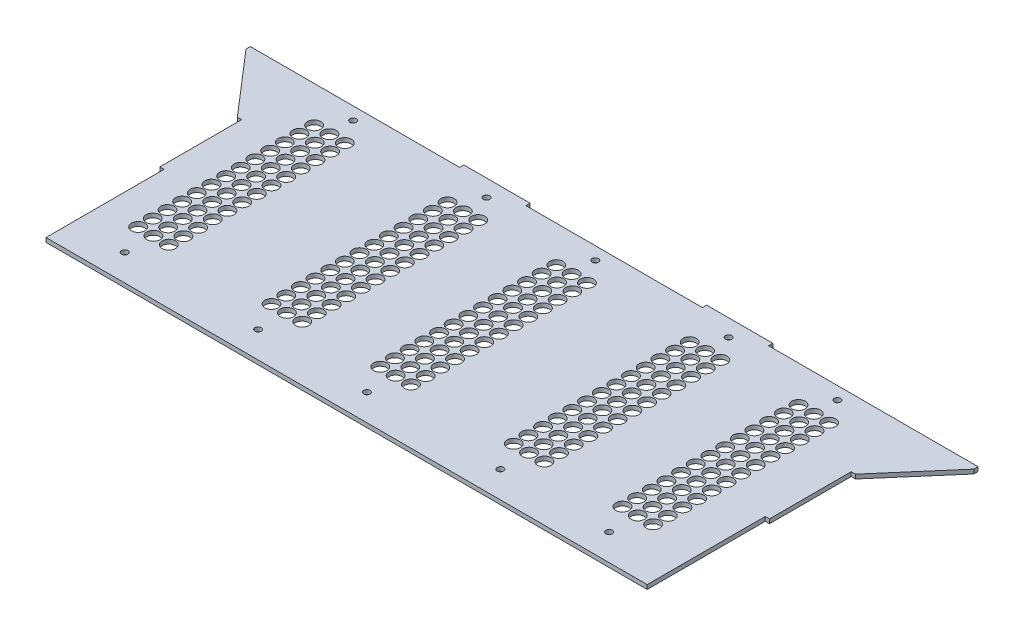
from build123d import *

# Parameters (mm, degrees)
SKETCH1_W                  = 457.2230066
SKETCH1_H                  = 3.175
BOSS_EXTRUDE1_DEPTH        = 200.6419914
BOSS_EXTRUDE3_DEPTH        = 3.175
SKETCH5_W                  = 3.175
SKETCH5_H                  = 88.514
CUT_EXTRUDE2_DEPTH         = 3.175
SKETCH3_W                  = 49.658811606
SKETCH3_H                  = 3.175
BOSS_EXTRUDE4_DEPTH        = 3.18
M4_CLEARANCE_HOLE1_D       = 4.8
LPATTERN5_COUNT            = 3
LPATTERN5_PITCH            = 181.61399999
M4_CLEARANCE_HOLE2_D       = 4.8
LPATTERN6_COUNT            = 2
LPATTERN6_PITCH            = 181.61399999
SKETCH10_R                 = 5
CUT_EXTRUDE3_DEPTH         = 339.72456808
LPATTERN1_COUNT            = 13
LPATTERN1_PITCH            = 11
LPATTERN2_COUNT            = 3
LPATTERN2_PITCH            = 181.61399999
LPATTERN2_COPY_1_SKETCH_R  = 5
LPATTERN2_COPY_1_DEPTH     = 339.72456808
LPATTERN2_COPY_2_SKETCH_R  = 5
LPATTERN2_COPY_2_DEPTH     = 339.72456808
LPATTERN2_COPY_3_SKETCH_R  = 5
LPATTERN2_COPY_3_DEPTH     = 339.72456808
LPATTERN2_COPY_4_SKETCH_R  = 5
LPATTERN2_COPY_4_DEPTH     = 339.72456808
LPATTERN2_COPY_5_SKETCH_R  = 5
LPATTERN2_COPY_5_DEPTH     = 339.72456808
LPATTERN2_COPY_6_SKETCH_R  = 5
LPATTERN2_COPY_6_DEPTH     = 339.72456808
LPATTERN2_COPY_7_SKETCH_R  = 5
LPATTERN2_COPY_7_DEPTH     = 339.72456808
LPATTERN2_COPY_8_SKETCH_R  = 5
LPATTERN2_COPY_8_DEPTH     = 339.72456808
LPATTERN2_COPY_9_SKETCH_R  = 5
LPATTERN2_COPY_9_DEPTH     = 339.72456808
LPATTERN2_COPY_10_SKETCH_R = 5
LPATTERN2_COPY_10_DEPTH    = 339.72456808
LPATTERN2_COPY_11_SKETCH_R = 5
LPATTERN2_COPY_11_DEPTH    = 339.72456808
LPATTERN2_COPY_12_SKETCH_R = 5
LPATTERN2_COPY_12_DEPTH    = 339.72456808
LPATTERN2_COPY_13_SKETCH_R = 5
LPATTERN2_COPY_13_DEPTH    = 339.72456808
LPATTERN2_COPY_14_SKETCH_R = 5
LPATTERN2_COPY_14_DEPTH    = 339.72456808
LPATTERN2_COPY_15_SKETCH_R = 5
LPATTERN2_COPY_15_DEPTH    = 339.72456808
LPATTERN2_COPY_16_SKETCH_R = 5
LPATTERN2_COPY_16_DEPTH    = 339.72456808
LPATTERN2_COPY_17_SKETCH_R = 5
LPATTERN2_COPY_17_DEPTH    = 339.72456808
LPATTERN2_COPY_18_SKETCH_R = 5
LPATTERN2_COPY_18_DEPTH    = 339.72456808
LPATTERN2_COPY_19_SKETCH_R = 5
LPATTERN2_COPY_19_DEPTH    = 339.72456808
LPATTERN2_COPY_20_SKETCH_R = 5
LPATTERN2_COPY_20_DEPTH    = 339.72456808
LPATTERN2_COPY_21_SKETCH_R = 5
LPATTERN2_COPY_21_DEPTH    = 339.72456808
LPATTERN2_COPY_22_SKETCH_R = 5
LPATTERN2_COPY_22_DEPTH    = 339.72456808
LPATTERN2_COPY_23_SKETCH_R = 5
LPATTERN2_COPY_23_DEPTH    = 339.72456808
LPATTERN2_COPY_24_SKETCH_R = 5
LPATTERN2_COPY_24_DEPTH    = 339.72456808
SKETCH11_R                 = 5
CUT_EXTRUDE4_DEPTH         = 339.72456808
LPATTERN3_COUNT            = 13
LPATTERN3_PITCH            = 11
LPATTERN4_COUNT            = 2
LPATTERN4_PITCH            = 181.61399999
LPATTERN4_COPY_1_SKETCH_R  = 5
LPATTERN4_COPY_1_DEPTH     = 339.72456808
LPATTERN4_COPY_2_SKETCH_R  = 5
LPATTERN4_COPY_2_DEPTH     = 339.72456808
LPATTERN4_COPY_3_SKETCH_R  = 5
LPATTERN4_COPY_3_DEPTH     = 339.72456808
LPATTERN4_COPY_4_SKETCH_R  = 5
LPATTERN4_COPY_4_DEPTH     = 339.72456808
LPATTERN4_COPY_5_SKETCH_R  = 5
LPATTERN4_COPY_5_DEPTH     = 339.72456808
LPATTERN4_COPY_6_SKETCH_R  = 5
LPATTERN4_COPY_6_DEPTH     = 339.72456808
LPATTERN4_COPY_7_SKETCH_R  = 5
LPATTERN4_COPY_7_DEPTH     = 339.72456808
LPATTERN4_COPY_8_SKETCH_R  = 5
LPATTERN4_COPY_8_DEPTH     = 339.72456808
LPATTERN4_COPY_9_SKETCH_R  = 5
LPATTERN4_COPY_9_DEPTH     = 339.72456808
LPATTERN4_COPY_10_SKETCH_R = 5
LPATTERN4_COPY_10_DEPTH    = 339.72456808
LPATTERN4_COPY_11_SKETCH_R = 5
LPATTERN4_COPY_11_DEPTH    = 339.72456808
LPATTERN4_COPY_12_SKETCH_R = 5
LPATTERN4_COPY_12_DEPTH    = 339.72456808


with BuildPart() as part:
    # Sketch1 → Boss-Extrude1 (new body)
    with BuildSketch(Plane.XY):
        Rectangle(SKETCH1_W, SKETCH1_H)
    extrude(amount=BOSS_EXTRUDE1_DEPTH)

    # Sketch4 → Boss-Extrude3 (add)
    with BuildSketch(Plane.XZ.offset(1.5875)):
        Polygon((-228.6115033, 0), (-272.8865033, 0), (-272.8865033, 3.175), (-231.7865033, 50.8), (-228.6115033, 50.8), align=None)
    boss_extrude3 = extrude(amount=-BOSS_EXTRUDE3_DEPTH)

    # Mirror1: Boss-Extrude3 across plane
    add(boss_extrude3.mirror(Plane(origin=(0, 0, 0), x_dir=(0, 0, 1), z_dir=(1, 0, 0))))

    # Sketch5 → Cut-Extrude2 (cut)
    with BuildSketch(Plane.XZ.offset(1.5875)):
        with Locations((-227.0240033, 156.3849914)):
            Rectangle(SKETCH5_W, SKETCH5_H)
    cut_extrude2 = extrude(amount=-CUT_EXTRUDE2_DEPTH, mode=Mode.SUBTRACT)

    # Mirror2: Cut-Extrude2 across plane
    add(cut_extrude2.mirror(Plane(origin=(0, 0, 0), x_dir=(0, 0, 1), z_dir=(1, 0, 0))), mode=Mode.SUBTRACT)

    # Sketch3 → Boss-Extrude4 (add)
    with BuildSketch(Plane(origin=(0, 0, 0), x_dir=(-1, 0, 0), z_dir=(0, 0, -1))):
        with Locations((-91.020094169, 0)):
            Rectangle(SKETCH3_W, SKETCH3_H)
        with Locations((91.020094169, 0)):
            Rectangle(SKETCH3_W, SKETCH3_H)
    extrude(amount=BOSS_EXTRUDE4_DEPTH)

    # M4 Clearance Hole1 (through all)
    with Locations(Plane.XZ.offset(1.5875)):
        with Locations((-186.2355, 9.525), (-186.2355, 180.775)):
            m4_clearance_hole1 = Hole(M4_CLEARANCE_HOLE1_D / 2)

    # LPattern5: M4 Clearance Hole1 ×3
    with Locations(*[(i * LPATTERN5_PITCH, 0, 0) for i in range(1, LPATTERN5_COUNT)]):
        add(m4_clearance_hole1, mode=Mode.SUBTRACT)

    # M4 Clearance Hole2 (through all)
    with Locations(Plane.XZ.offset(1.5875)):
        with Locations((-86.1905, 9.525), (-86.1905, 180.775)):
            m4_clearance_hole2 = Hole(M4_CLEARANCE_HOLE2_D / 2)

    # LPattern6: M4 Clearance Hole2 ×2
    with Locations(*[(i * LPATTERN6_PITCH, 0, 0) for i in range(1, LPATTERN6_COUNT)]):
        add(m4_clearance_hole2, mode=Mode.SUBTRACT)

    # Sketch10 → Cut-Extrude3 (cut, through all)
    with BuildSketch(Plane.XZ.offset(1.5875)):
        with Locations(Location((-197.7355, 159.256662939, 0), (0, 0, 270))):
            Circle(SKETCH10_R)
        with Locations(Location((-186.2355, 159.256662939, 0), (0, 0, 270))):
            Circle(SKETCH10_R)
        with Locations(Location((-174.7355, 159.256662939, 0), (0, 0, 270))):
            Circle(SKETCH10_R)
    cut_extrude3 = extrude(amount=-CUT_EXTRUDE3_DEPTH, mode=Mode.SUBTRACT)

    # LPattern1: Cut-Extrude3 ×13
    with Locations(*[(0, 0, -i * LPATTERN1_PITCH) for i in range(1, LPATTERN1_COUNT)]):
        add(cut_extrude3, mode=Mode.SUBTRACT)

    # LPattern2: Cut-Extrude3 ×3
    with Locations(*[(i * LPATTERN2_PITCH, 0, 0) for i in range(1, LPATTERN2_COUNT)]):
        add(cut_extrude3, mode=Mode.SUBTRACT)

    # LPattern2 copy 1 sketch → LPattern2 copy 1 (cut, through all)
    with BuildSketch(Plane(origin=(181.61399999, -1.5875, -11), x_dir=(1, 0, 0), z_dir=(0, -1, 0))):
        with Locations(Location((-197.7355, 159.256662939, 0), (0, 0, 270))):
            Circle(LPATTERN2_COPY_1_SKETCH_R)
        with Locations(Location((-186.2355, 159.256662939, 0), (0, 0, 270))):
            Circle(LPATTERN2_COPY_1_SKETCH_R)
        with Locations(Location((-174.7355, 159.256662939, 0), (0, 0, 270))):
            Circle(LPATTERN2_COPY_1_SKETCH_R)
    extrude(amount=-LPATTERN2_COPY_1_DEPTH, mode=Mode.SUBTRACT)

    # LPattern2 copy 2 sketch → LPattern2 copy 2 (cut, through all)
    with BuildSketch(Plane(origin=(363.22799998, -1.5875, -11), x_dir=(1, 0, 0), z_dir=(0, -1, 0))):
        with Locations(Location((-197.7355, 159.256662939, 0), (0, 0, 270))):
            Circle(LPATTERN2_COPY_2_SKETCH_R)
        with Locations(Location((-186.2355, 159.256662939, 0), (0, 0, 270))):
            Circle(LPATTERN2_COPY_2_SKETCH_R)
        with Locations(Location((-174.7355, 159.256662939, 0), (0, 0, 270))):
            Circle(LPATTERN2_COPY_2_SKETCH_R)
    extrude(amount=-LPATTERN2_COPY_2_DEPTH, mode=Mode.SUBTRACT)

    # LPattern2 copy 3 sketch → LPattern2 copy 3 (cut, through all)
    with BuildSketch(Plane(origin=(181.61399999, -1.5875, -22), x_dir=(1, 0, 0), z_dir=(0, -1, 0))):
        with Locations(Location((-197.7355, 159.256662939, 0), (0, 0, 270))):
            Circle(LPATTERN2_COPY_3_SKETCH_R)
        with Locations(Location((-186.2355, 159.256662939, 0), (0, 0, 270))):
            Circle(LPATTERN2_COPY_3_SKETCH_R)
        with Locations(Location((-174.7355, 159.256662939, 0), (0, 0, 270))):
            Circle(LPATTERN2_COPY_3_SKETCH_R)
    extrude(amount=-LPATTERN2_COPY_3_DEPTH, mode=Mode.SUBTRACT)

    # LPattern2 copy 4 sketch → LPattern2 copy 4 (cut, through all)
    with BuildSketch(Plane(origin=(363.22799998, -1.5875, -22), x_dir=(1, 0, 0), z_dir=(0, -1, 0))):
        with Locations(Location((-197.7355, 159.256662939, 0), (0, 0, 270))):
            Circle(LPATTERN2_COPY_4_SKETCH_R)
        with Locations(Location((-186.2355, 159.256662939, 0), (0, 0, 270))):
            Circle(LPATTERN2_COPY_4_SKETCH_R)
        with Locations(Location((-174.7355, 159.256662939, 0), (0, 0, 270))):
            Circle(LPATTERN2_COPY_4_SKETCH_R)
    extrude(amount=-LPATTERN2_COPY_4_DEPTH, mode=Mode.SUBTRACT)

    # LPattern2 copy 5 sketch → LPattern2 copy 5 (cut, through all)
    with BuildSketch(Plane(origin=(181.61399999, -1.5875, -33), x_dir=(1, 0, 0), z_dir=(0, -1, 0))):
        with Locations(Location((-197.7355, 159.256662939, 0), (0, 0, 270))):
            Circle(LPATTERN2_COPY_5_SKETCH_R)
        with Locations(Location((-186.2355, 159.256662939, 0), (0, 0, 270))):
            Circle(LPATTERN2_COPY_5_SKETCH_R)
        with Locations(Location((-174.7355, 159.256662939, 0), (0, 0, 270))):
            Circle(LPATTERN2_COPY_5_SKETCH_R)
    extrude(amount=-LPATTERN2_COPY_5_DEPTH, mode=Mode.SUBTRACT)

    # LPattern2 copy 6 sketch → LPattern2 copy 6 (cut, through all)
    with BuildSketch(Plane(origin=(363.22799998, -1.5875, -33), x_dir=(1, 0, 0), z_dir=(0, -1, 0))):
        with Locations(Location((-197.7355, 159.256662939, 0), (0, 0, 270))):
            Circle(LPATTERN2_COPY_6_SKETCH_R)
        with Locations(Location((-186.2355, 159.256662939, 0), (0, 0, 270))):
            Circle(LPATTERN2_COPY_6_SKETCH_R)
        with Locations(Location((-174.7355, 159.256662939, 0), (0, 0, 270))):
            Circle(LPATTERN2_COPY_6_SKETCH_R)
    extrude(amount=-LPATTERN2_COPY_6_DEPTH, mode=Mode.SUBTRACT)

    # LPattern2 copy 7 sketch → LPattern2 copy 7 (cut, through all)
    with BuildSketch(Plane(origin=(181.61399999, -1.5875, -44), x_dir=(1, 0, 0), z_dir=(0, -1, 0))):
        with Locations(Location((-197.7355, 159.256662939, 0), (0, 0, 270))):
            Circle(LPATTERN2_COPY_7_SKETCH_R)
        with Locations(Location((-186.2355, 159.256662939, 0), (0, 0, 270))):
            Circle(LPATTERN2_COPY_7_SKETCH_R)
        with Locations(Location((-174.7355, 159.256662939, 0), (0, 0, 270))):
            Circle(LPATTERN2_COPY_7_SKETCH_R)
    extrude(amount=-LPATTERN2_COPY_7_DEPTH, mode=Mode.SUBTRACT)

    # LPattern2 copy 8 sketch → LPattern2 copy 8 (cut, through all)
    with BuildSketch(Plane(origin=(363.22799998, -1.5875, -44), x_dir=(1, 0, 0), z_dir=(0, -1, 0))):
        with Locations(Location((-197.7355, 159.256662939, 0), (0, 0, 270))):
            Circle(LPATTERN2_COPY_8_SKETCH_R)
        with Locations(Location((-186.2355, 159.256662939, 0), (0, 0, 270))):
            Circle(LPATTERN2_COPY_8_SKETCH_R)
        with Locations(Location((-174.7355, 159.256662939, 0), (0, 0, 270))):
            Circle(LPATTERN2_COPY_8_SKETCH_R)
    extrude(amount=-LPATTERN2_COPY_8_DEPTH, mode=Mode.SUBTRACT)

    # LPattern2 copy 9 sketch → LPattern2 copy 9 (cut, through all)
    with BuildSketch(Plane(origin=(181.61399999, -1.5875, -55), x_dir=(1, 0, 0), z_dir=(0, -1, 0))):
        with Locations(Location((-197.7355, 159.256662939, 0), (0, 0, 270))):
            Circle(LPATTERN2_COPY_9_SKETCH_R)
        with Locations(Location((-186.2355, 159.256662939, 0), (0, 0, 270))):
            Circle(LPATTERN2_COPY_9_SKETCH_R)
        with Locations(Location((-174.7355, 159.256662939, 0), (0, 0, 270))):
            Circle(LPATTERN2_COPY_9_SKETCH_R)
    extrude(amount=-LPATTERN2_COPY_9_DEPTH, mode=Mode.SUBTRACT)

    # LPattern2 copy 10 sketch → LPattern2 copy 10 (cut, through all)
    with BuildSketch(Plane(origin=(363.22799998, -1.5875, -55), x_dir=(1, 0, 0), z_dir=(0, -1, 0))):
        with Locations(Location((-197.7355, 159.256662939, 0), (0, 0, 270))):
            Circle(LPATTERN2_COPY_10_SKETCH_R)
        with Locations(Location((-186.2355, 159.256662939, 0), (0, 0, 270))):
            Circle(LPATTERN2_COPY_10_SKETCH_R)
        with Locations(Location((-174.7355, 159.256662939, 0), (0, 0, 270))):
            Circle(LPATTERN2_COPY_10_SKETCH_R)
    extrude(amount=-LPATTERN2_COPY_10_DEPTH, mode=Mode.SUBTRACT)

    # LPattern2 copy 11 sketch → LPattern2 copy 11 (cut, through all)
    with BuildSketch(Plane(origin=(181.61399999, -1.5875, -66), x_dir=(1, 0, 0), z_dir=(0, -1, 0))):
        with Locations(Location((-197.7355, 159.256662939, 0), (0, 0, 270))):
            Circle(LPATTERN2_COPY_11_SKETCH_R)
        with Locations(Location((-186.2355, 159.256662939, 0), (0, 0, 270))):
            Circle(LPATTERN2_COPY_11_SKETCH_R)
        with Locations(Location((-174.7355, 159.256662939, 0), (0, 0, 270))):
            Circle(LPATTERN2_COPY_11_SKETCH_R)
    extrude(amount=-LPATTERN2_COPY_11_DEPTH, mode=Mode.SUBTRACT)

    # LPattern2 copy 12 sketch → LPattern2 copy 12 (cut, through all)
    with BuildSketch(Plane(origin=(363.22799998, -1.5875, -66), x_dir=(1, 0, 0), z_dir=(0, -1, 0))):
        with Locations(Location((-197.7355, 159.256662939, 0), (0, 0, 270))):
            Circle(LPATTERN2_COPY_12_SKETCH_R)
        with Locations(Location((-186.2355, 159.256662939, 0), (0, 0, 270))):
            Circle(LPATTERN2_COPY_12_SKETCH_R)
        with Locations(Location((-174.7355, 159.256662939, 0), (0, 0, 270))):
            Circle(LPATTERN2_COPY_12_SKETCH_R)
    extrude(amount=-LPATTERN2_COPY_12_DEPTH, mode=Mode.SUBTRACT)

    # LPattern2 copy 13 sketch → LPattern2 copy 13 (cut, through all)
    with BuildSketch(Plane(origin=(181.61399999, -1.5875, -77), x_dir=(1, 0, 0), z_dir=(0, -1, 0))):
        with Locations(Location((-197.7355, 159.256662939, 0), (0, 0, 270))):
            Circle(LPATTERN2_COPY_13_SKETCH_R)
        with Locations(Location((-186.2355, 159.256662939, 0), (0, 0, 270))):
            Circle(LPATTERN2_COPY_13_SKETCH_R)
        with Locations(Location((-174.7355, 159.256662939, 0), (0, 0, 270))):
            Circle(LPATTERN2_COPY_13_SKETCH_R)
    extrude(amount=-LPATTERN2_COPY_13_DEPTH, mode=Mode.SUBTRACT)

    # LPattern2 copy 14 sketch → LPattern2 copy 14 (cut, through all)
    with BuildSketch(Plane(origin=(363.22799998, -1.5875, -77), x_dir=(1, 0, 0), z_dir=(0, -1, 0))):
        with Locations(Location((-197.7355, 159.256662939, 0), (0, 0, 270))):
            Circle(LPATTERN2_COPY_14_SKETCH_R)
        with Locations(Location((-186.2355, 159.256662939, 0), (0, 0, 270))):
            Circle(LPATTERN2_COPY_14_SKETCH_R)
        with Locations(Location((-174.7355, 159.256662939, 0), (0, 0, 270))):
            Circle(LPATTERN2_COPY_14_SKETCH_R)
    extrude(amount=-LPATTERN2_COPY_14_DEPTH, mode=Mode.SUBTRACT)

    # LPattern2 copy 15 sketch → LPattern2 copy 15 (cut, through all)
    with BuildSketch(Plane(origin=(181.61399999, -1.5875, -88), x_dir=(1, 0, 0), z_dir=(0, -1, 0))):
        with Locations(Location((-197.7355, 159.256662939, 0), (0, 0, 270))):
            Circle(LPATTERN2_COPY_15_SKETCH_R)
        with Locations(Location((-186.2355, 159.256662939, 0), (0, 0, 270))):
            Circle(LPATTERN2_COPY_15_SKETCH_R)
        with Locations(Location((-174.7355, 159.256662939, 0), (0, 0, 270))):
            Circle(LPATTERN2_COPY_15_SKETCH_R)
    extrude(amount=-LPATTERN2_COPY_15_DEPTH, mode=Mode.SUBTRACT)

    # LPattern2 copy 16 sketch → LPattern2 copy 16 (cut, through all)
    with BuildSketch(Plane(origin=(363.22799998, -1.5875, -88), x_dir=(1, 0, 0), z_dir=(0, -1, 0))):
        with Locations(Location((-197.7355, 159.256662939, 0), (0, 0, 270))):
            Circle(LPATTERN2_COPY_16_SKETCH_R)
        with Locations(Location((-186.2355, 159.256662939, 0), (0, 0, 270))):
            Circle(LPATTERN2_COPY_16_SKETCH_R)
        with Locations(Location((-174.7355, 159.256662939, 0), (0, 0, 270))):
            Circle(LPATTERN2_COPY_16_SKETCH_R)
    extrude(amount=-LPATTERN2_COPY_16_DEPTH, mode=Mode.SUBTRACT)

    # LPattern2 copy 17 sketch → LPattern2 copy 17 (cut, through all)
    with BuildSketch(Plane(origin=(181.61399999, -1.5875, -99), x_dir=(1, 0, 0), z_dir=(0, -1, 0))):
        with Locations(Location((-197.7355, 159.256662939, 0), (0, 0, 270))):
            Circle(LPATTERN2_COPY_17_SKETCH_R)
        with Locations(Location((-186.2355, 159.256662939, 0), (0, 0, 270))):
            Circle(LPATTERN2_COPY_17_SKETCH_R)
        with Locations(Location((-174.7355, 159.256662939, 0), (0, 0, 270))):
            Circle(LPATTERN2_COPY_17_SKETCH_R)
    extrude(amount=-LPATTERN2_COPY_17_DEPTH, mode=Mode.SUBTRACT)

    # LPattern2 copy 18 sketch → LPattern2 copy 18 (cut, through all)
    with BuildSketch(Plane(origin=(363.22799998, -1.5875, -99), x_dir=(1, 0, 0), z_dir=(0, -1, 0))):
        with Locations(Location((-197.7355, 159.256662939, 0), (0, 0, 270))):
            Circle(LPATTERN2_COPY_18_SKETCH_R)
        with Locations(Location((-186.2355, 159.256662939, 0), (0, 0, 270))):
            Circle(LPATTERN2_COPY_18_SKETCH_R)
        with Locations(Location((-174.7355, 159.256662939, 0), (0, 0, 270))):
            Circle(LPATTERN2_COPY_18_SKETCH_R)
    extrude(amount=-LPATTERN2_COPY_18_DEPTH, mode=Mode.SUBTRACT)

    # LPattern2 copy 19 sketch → LPattern2 copy 19 (cut, through all)
    with BuildSketch(Plane(origin=(181.61399999, -1.5875, -110), x_dir=(1, 0, 0), z_dir=(0, -1, 0))):
        with Locations(Location((-197.7355, 159.256662939, 0), (0, 0, 270))):
            Circle(LPATTERN2_COPY_19_SKETCH_R)
        with Locations(Location((-186.2355, 159.256662939, 0), (0, 0, 270))):
            Circle(LPATTERN2_COPY_19_SKETCH_R)
        with Locations(Location((-174.7355, 159.256662939, 0), (0, 0, 270))):
            Circle(LPATTERN2_COPY_19_SKETCH_R)
    extrude(amount=-LPATTERN2_COPY_19_DEPTH, mode=Mode.SUBTRACT)

    # LPattern2 copy 20 sketch → LPattern2 copy 20 (cut, through all)
    with BuildSketch(Plane(origin=(363.22799998, -1.5875, -110), x_dir=(1, 0, 0), z_dir=(0, -1, 0))):
        with Locations(Location((-197.7355, 159.256662939, 0), (0, 0, 270))):
            Circle(LPATTERN2_COPY_20_SKETCH_R)
        with Locations(Location((-186.2355, 159.256662939, 0), (0, 0, 270))):
            Circle(LPATTERN2_COPY_20_SKETCH_R)
        with Locations(Location((-174.7355, 159.256662939, 0), (0, 0, 270))):
            Circle(LPATTERN2_COPY_20_SKETCH_R)
    extrude(amount=-LPATTERN2_COPY_20_DEPTH, mode=Mode.SUBTRACT)

    # LPattern2 copy 21 sketch → LPattern2 copy 21 (cut, through all)
    with BuildSketch(Plane(origin=(181.61399999, -1.5875, -121), x_dir=(1, 0, 0), z_dir=(0, -1, 0))):
        with Locations(Location((-197.7355, 159.256662939, 0), (0, 0, 270))):
            Circle(LPATTERN2_COPY_21_SKETCH_R)
        with Locations(Location((-186.2355, 159.256662939, 0), (0, 0, 270))):
            Circle(LPATTERN2_COPY_21_SKETCH_R)
        with Locations(Location((-174.7355, 159.256662939, 0), (0, 0, 270))):
            Circle(LPATTERN2_COPY_21_SKETCH_R)
    extrude(amount=-LPATTERN2_COPY_21_DEPTH, mode=Mode.SUBTRACT)

    # LPattern2 copy 22 sketch → LPattern2 copy 22 (cut, through all)
    with BuildSketch(Plane(origin=(363.22799998, -1.5875, -121), x_dir=(1, 0, 0), z_dir=(0, -1, 0))):
        with Locations(Location((-197.7355, 159.256662939, 0), (0, 0, 270))):
            Circle(LPATTERN2_COPY_22_SKETCH_R)
        with Locations(Location((-186.2355, 159.256662939, 0), (0, 0, 270))):
            Circle(LPATTERN2_COPY_22_SKETCH_R)
        with Locations(Location((-174.7355, 159.256662939, 0), (0, 0, 270))):
            Circle(LPATTERN2_COPY_22_SKETCH_R)
    extrude(amount=-LPATTERN2_COPY_22_DEPTH, mode=Mode.SUBTRACT)

    # LPattern2 copy 23 sketch → LPattern2 copy 23 (cut, through all)
    with BuildSketch(Plane(origin=(181.61399999, -1.5875, -132), x_dir=(1, 0, 0), z_dir=(0, -1, 0))):
        with Locations(Location((-197.7355, 159.256662939, 0), (0, 0, 270))):
            Circle(LPATTERN2_COPY_23_SKETCH_R)
        with Locations(Location((-186.2355, 159.256662939, 0), (0, 0, 270))):
            Circle(LPATTERN2_COPY_23_SKETCH_R)
        with Locations(Location((-174.7355, 159.256662939, 0), (0, 0, 270))):
            Circle(LPATTERN2_COPY_23_SKETCH_R)
    extrude(amount=-LPATTERN2_COPY_23_DEPTH, mode=Mode.SUBTRACT)

    # LPattern2 copy 24 sketch → LPattern2 copy 24 (cut, through all)
    with BuildSketch(Plane(origin=(363.22799998, -1.5875, -132), x_dir=(1, 0, 0), z_dir=(0, -1, 0))):
        with Locations(Location((-197.7355, 159.256662939, 0), (0, 0, 270))):
            Circle(LPATTERN2_COPY_24_SKETCH_R)
        with Locations(Location((-186.2355, 159.256662939, 0), (0, 0, 270))):
            Circle(LPATTERN2_COPY_24_SKETCH_R)
        with Locations(Location((-174.7355, 159.256662939, 0), (0, 0, 270))):
            Circle(LPATTERN2_COPY_24_SKETCH_R)
    extrude(amount=-LPATTERN2_COPY_24_DEPTH, mode=Mode.SUBTRACT)

    # Sketch11 → Cut-Extrude4 (cut, through all)
    with BuildSketch(Plane.XZ.offset(1.5875)):
        with Locations(Location((-97.6905, 159.256662939, 0), (0, 0, 270))):
            Circle(SKETCH11_R)
        with Locations(Location((-86.1905, 159.256662939, 0), (0, 0, 270))):
            Circle(SKETCH11_R)
        with Locations(Location((-74.6905, 159.256662939, 0), (0, 0, 270))):
            Circle(SKETCH11_R)
    cut_extrude4 = extrude(amount=-CUT_EXTRUDE4_DEPTH, mode=Mode.SUBTRACT)

    # LPattern3: Cut-Extrude4 ×13
    with Locations(*[(0, 0, -i * LPATTERN3_PITCH) for i in range(1, LPATTERN3_COUNT)]):
        add(cut_extrude4, mode=Mode.SUBTRACT)

    # LPattern4: Cut-Extrude4 ×2
    with Locations(*[(i * LPATTERN4_PITCH, 0, 0) for i in range(1, LPATTERN4_COUNT)]):
        add(cut_extrude4, mode=Mode.SUBTRACT)

    # LPattern4 copy 1 sketch → LPattern4 copy 1 (cut, through all)
    with BuildSketch(Plane(origin=(181.61399999, -1.5875, -11), x_dir=(1, 0, 0), z_dir=(0, -1, 0))):
        with Locations(Location((-97.6905, 159.256662939, 0), (0, 0, 270))):
            Circle(LPATTERN4_COPY_1_SKETCH_R)
        with Locations(Location((-86.1905, 159.256662939, 0), (0, 0, 270))):
            Circle(LPATTERN4_COPY_1_SKETCH_R)
        with Locations(Location((-74.6905, 159.256662939, 0), (0, 0, 270))):
            Circle(LPATTERN4_COPY_1_SKETCH_R)
    extrude(amount=-LPATTERN4_COPY_1_DEPTH, mode=Mode.SUBTRACT)

    # LPattern4 copy 2 sketch → LPattern4 copy 2 (cut, through all)
    with BuildSketch(Plane(origin=(181.61399999, -1.5875, -22), x_dir=(1, 0, 0), z_dir=(0, -1, 0))):
        with Locations(Location((-97.6905, 159.256662939, 0), (0, 0, 270))):
            Circle(LPATTERN4_COPY_2_SKETCH_R)
        with Locations(Location((-86.1905, 159.256662939, 0), (0, 0, 270))):
            Circle(LPATTERN4_COPY_2_SKETCH_R)
        with Locations(Location((-74.6905, 159.256662939, 0), (0, 0, 270))):
            Circle(LPATTERN4_COPY_2_SKETCH_R)
    extrude(amount=-LPATTERN4_COPY_2_DEPTH, mode=Mode.SUBTRACT)

    # LPattern4 copy 3 sketch → LPattern4 copy 3 (cut, through all)
    with BuildSketch(Plane(origin=(181.61399999, -1.5875, -33), x_dir=(1, 0, 0), z_dir=(0, -1, 0))):
        with Locations(Location((-97.6905, 159.256662939, 0), (0, 0, 270))):
            Circle(LPATTERN4_COPY_3_SKETCH_R)
        with Locations(Location((-86.1905, 159.256662939, 0), (0, 0, 270))):
            Circle(LPATTERN4_COPY_3_SKETCH_R)
        with Locations(Location((-74.6905, 159.256662939, 0), (0, 0, 270))):
            Circle(LPATTERN4_COPY_3_SKETCH_R)
    extrude(amount=-LPATTERN4_COPY_3_DEPTH, mode=Mode.SUBTRACT)

    # LPattern4 copy 4 sketch → LPattern4 copy 4 (cut, through all)
    with BuildSketch(Plane(origin=(181.61399999, -1.5875, -44), x_dir=(1, 0, 0), z_dir=(0, -1, 0))):
        with Locations(Location((-97.6905, 159.256662939, 0), (0, 0, 270))):
            Circle(LPATTERN4_COPY_4_SKETCH_R)
        with Locations(Location((-86.1905, 159.256662939, 0), (0, 0, 270))):
            Circle(LPATTERN4_COPY_4_SKETCH_R)
        with Locations(Location((-74.6905, 159.256662939, 0), (0, 0, 270))):
            Circle(LPATTERN4_COPY_4_SKETCH_R)
    extrude(amount=-LPATTERN4_COPY_4_DEPTH, mode=Mode.SUBTRACT)

    # LPattern4 copy 5 sketch → LPattern4 copy 5 (cut, through all)
    with BuildSketch(Plane(origin=(181.61399999, -1.5875, -55), x_dir=(1, 0, 0), z_dir=(0, -1, 0))):
        with Locations(Location((-97.6905, 159.256662939, 0), (0, 0, 270))):
            Circle(LPATTERN4_COPY_5_SKETCH_R)
        with Locations(Location((-86.1905, 159.256662939, 0), (0, 0, 270))):
            Circle(LPATTERN4_COPY_5_SKETCH_R)
        with Locations(Location((-74.6905, 159.256662939, 0), (0, 0, 270))):
            Circle(LPATTERN4_COPY_5_SKETCH_R)
    extrude(amount=-LPATTERN4_COPY_5_DEPTH, mode=Mode.SUBTRACT)

    # LPattern4 copy 6 sketch → LPattern4 copy 6 (cut, through all)
    with BuildSketch(Plane(origin=(181.61399999, -1.5875, -66), x_dir=(1, 0, 0), z_dir=(0, -1, 0))):
        with Locations(Location((-97.6905, 159.256662939, 0), (0, 0, 270))):
            Circle(LPATTERN4_COPY_6_SKETCH_R)
        with Locations(Location((-86.1905, 159.256662939, 0), (0, 0, 270))):
            Circle(LPATTERN4_COPY_6_SKETCH_R)
        with Locations(Location((-74.6905, 159.256662939, 0), (0, 0, 270))):
            Circle(LPATTERN4_COPY_6_SKETCH_R)
    extrude(amount=-LPATTERN4_COPY_6_DEPTH, mode=Mode.SUBTRACT)

    # LPattern4 copy 7 sketch → LPattern4 copy 7 (cut, through all)
    with BuildSketch(Plane(origin=(181.61399999, -1.5875, -77), x_dir=(1, 0, 0), z_dir=(0, -1, 0))):
        with Locations(Location((-97.6905, 159.256662939, 0), (0, 0, 270))):
            Circle(LPATTERN4_COPY_7_SKETCH_R)
        with Locations(Location((-86.1905, 159.256662939, 0), (0, 0, 270))):
            Circle(LPATTERN4_COPY_7_SKETCH_R)
        with Locations(Location((-74.6905, 159.256662939, 0), (0, 0, 270))):
            Circle(LPATTERN4_COPY_7_SKETCH_R)
    extrude(amount=-LPATTERN4_COPY_7_DEPTH, mode=Mode.SUBTRACT)

    # LPattern4 copy 8 sketch → LPattern4 copy 8 (cut, through all)
    with BuildSketch(Plane(origin=(181.61399999, -1.5875, -88), x_dir=(1, 0, 0), z_dir=(0, -1, 0))):
        with Locations(Location((-97.6905, 159.256662939, 0), (0, 0, 270))):
            Circle(LPATTERN4_COPY_8_SKETCH_R)
        with Locations(Location((-86.1905, 159.256662939, 0), (0, 0, 270))):
            Circle(LPATTERN4_COPY_8_SKETCH_R)
        with Locations(Location((-74.6905, 159.256662939, 0), (0, 0, 270))):
            Circle(LPATTERN4_COPY_8_SKETCH_R)
    extrude(amount=-LPATTERN4_COPY_8_DEPTH, mode=Mode.SUBTRACT)

    # LPattern4 copy 9 sketch → LPattern4 copy 9 (cut, through all)
    with BuildSketch(Plane(origin=(181.61399999, -1.5875, -99), x_dir=(1, 0, 0), z_dir=(0, -1, 0))):
        with Locations(Location((-97.6905, 159.256662939, 0), (0, 0, 270))):
            Circle(LPATTERN4_COPY_9_SKETCH_R)
        with Locations(Location((-86.1905, 159.256662939, 0), (0, 0, 270))):
            Circle(LPATTERN4_COPY_9_SKETCH_R)
        with Locations(Location((-74.6905, 159.256662939, 0), (0, 0, 270))):
            Circle(LPATTERN4_COPY_9_SKETCH_R)
    extrude(amount=-LPATTERN4_COPY_9_DEPTH, mode=Mode.SUBTRACT)

    # LPattern4 copy 10 sketch → LPattern4 copy 10 (cut, through all)
    with BuildSketch(Plane(origin=(181.61399999, -1.5875, -110), x_dir=(1, 0, 0), z_dir=(0, -1, 0))):
        with Locations(Location((-97.6905, 159.256662939, 0), (0, 0, 270))):
            Circle(LPATTERN4_COPY_10_SKETCH_R)
        with Locations(Location((-86.1905, 159.256662939, 0), (0, 0, 270))):
            Circle(LPATTERN4_COPY_10_SKETCH_R)
        with Locations(Location((-74.6905, 159.256662939, 0), (0, 0, 270))):
            Circle(LPATTERN4_COPY_10_SKETCH_R)
    extrude(amount=-LPATTERN4_COPY_10_DEPTH, mode=Mode.SUBTRACT)

    # LPattern4 copy 11 sketch → LPattern4 copy 11 (cut, through all)
    with BuildSketch(Plane(origin=(181.61399999, -1.5875, -121), x_dir=(1, 0, 0), z_dir=(0, -1, 0))):
        with Locations(Location((-97.6905, 159.256662939, 0), (0, 0, 270))):
            Circle(LPATTERN4_COPY_11_SKETCH_R)
        with Locations(Location((-86.1905, 159.256662939, 0), (0, 0, 270))):
            Circle(LPATTERN4_COPY_11_SKETCH_R)
        with Locations(Location((-74.6905, 159.256662939, 0), (0, 0, 270))):
            Circle(LPATTERN4_COPY_11_SKETCH_R)
    extrude(amount=-LPATTERN4_COPY_11_DEPTH, mode=Mode.SUBTRACT)

    # LPattern4 copy 12 sketch → LPattern4 copy 12 (cut, through all)
    with BuildSketch(Plane(origin=(181.61399999, -1.5875, -132), x_dir=(1, 0, 0), z_dir=(0, -1, 0))):
        with Locations(Location((-97.6905, 159.256662939, 0), (0, 0, 270))):
            Circle(LPATTERN4_COPY_12_SKETCH_R)
        with Locations(Location((-86.1905, 159.256662939, 0), (0, 0, 270))):
            Circle(LPATTERN4_COPY_12_SKETCH_R)
        with Locations(Location((-74.6905, 159.256662939, 0), (0, 0, 270))):
            Circle(LPATTERN4_COPY_12_SKETCH_R)
    extrude(amount=-LPATTERN4_COPY_12_DEPTH, mode=Mode.SUBTRACT)


solid = part.part
